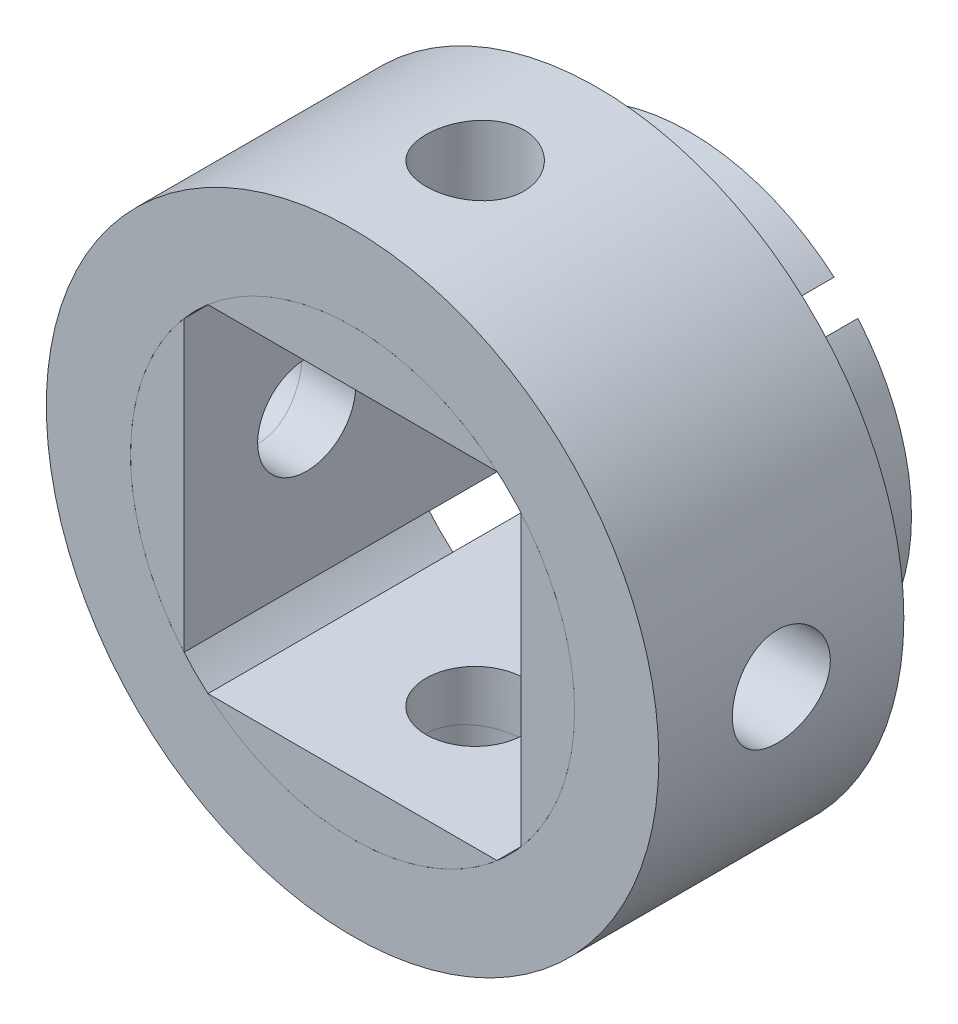
from build123d import *

# Parameters (mm, degrees)
SKETCH_1_R               = 10
SKETCH_1_R_2             = 7.25
EXTRUDE_1_DEPTH          = 8
SKETCH_2_R               = 1.6
CUT_EXTRUDE_1_DEPTH      = 17.248076809
SKETCH_3_R               = 1.6
CUT_EXTRUDE_2_DEPTH      = 17.248076998
EXTRUDE_2_DEPTH          = 8
EXTRUDE_2_DEPTH_BACK     = 3
EXTRUDE_2_2_DEPTH        = 8
EXTRUDE_2_2_DEPTH_BACK   = 3
EXTRUDE_2_3_DEPTH        = 8
EXTRUDE_2_3_DEPTH_BACK   = 3
EXTRUDE_2_4_DEPTH        = 8
EXTRUDE_2_4_DEPTH_BACK   = 3
SKETCH_2_2_R             = 1.6
CUT_EXTRUDE_3_DEPTH      = 17.248076998
CUT_EXTRUDE_5_DEPTH      = 17.248076998
CUT_EXTRUDE_5_DEPTH_BACK = 17.248076998
SKETCH_3_3_R             = 1.6
SKETCH_2_3_R             = 1.6
CUT_EXTRUDE_6_DEPTH      = 17.248076998


with BuildPart() as part:
    # 草图1 → 凸台-拉伸1 (new body)
    with BuildSketch(Plane.XY):
        Circle(SKETCH_1_R)
        Circle(SKETCH_1_R_2, mode=Mode.SUBTRACT)
    extrude(amount=EXTRUDE_1_DEPTH)

    # 草图2 → 切除-拉伸1 (cut, through all)
    with BuildSketch(Plane(origin=(0, 0, 0), x_dir=(1, 0, 0), z_dir=(0, 1, 0))):
        with Locations((0, -4)):
            Circle(SKETCH_2_R)
    extrude(amount=-CUT_EXTRUDE_1_DEPTH, mode=Mode.SUBTRACT)

    # 草图3 → 切除-拉伸2 (cut, through all)
    with BuildSketch(Plane(origin=(0, 0, 0), x_dir=(0, 0, -1), z_dir=(1, 0, 0))):
        with Locations((-4, 0)):
            Circle(SKETCH_3_R)
    extrude(amount=-CUT_EXTRUDE_2_DEPTH, mode=Mode.SUBTRACT)


with BuildPart() as body_2:
    # 草图5 → 凸台-拉伸2 (new, two sides: drawn at the far end of the back side and taken through both)
    with BuildSketch(Plane.XY.offset(-EXTRUDE_2_DEPTH_BACK)):
        with BuildLine():
            Line((4.723610907, 5.5), (-4.723610907, 5.5))
            ThreePointArc((-4.723610907, 5.5), (0, 7.25), (4.723610907, 5.5))
        make_face()
    extrude(amount=EXTRUDE_2_DEPTH + EXTRUDE_2_DEPTH_BACK)


with BuildPart() as body_3:
    # 草图5 → Extrude 2 2 (new, two sides: drawn at the far end of the back side and taken through both)
    with BuildSketch(Plane.XY.offset(-EXTRUDE_2_2_DEPTH_BACK)):
        with BuildLine():
            Line((5.5, -4.723610907), (5.5, 4.723610907))
            ThreePointArc((5.5, 4.723610907), (7.25, 0), (5.5, -4.723610907))
        make_face()
    extrude(amount=EXTRUDE_2_2_DEPTH + EXTRUDE_2_2_DEPTH_BACK)


with BuildPart() as body_4:
    # 草图5 → Extrude 2 3 (new, two sides: drawn at the far end of the back side and taken through both)
    with BuildSketch(Plane.XY.offset(-EXTRUDE_2_3_DEPTH_BACK)):
        with BuildLine():
            Line((-4.723610907, -5.5), (4.723610907, -5.5))
            ThreePointArc((4.723610907, -5.5), (0, -7.25), (-4.723610907, -5.5))
        make_face()
    extrude(amount=EXTRUDE_2_3_DEPTH + EXTRUDE_2_3_DEPTH_BACK)

    # 草图2<2> → 切除-拉伸3 (cut, through all)
    with BuildSketch(Plane(origin=(0, 0, 0), x_dir=(1, 0, 0), z_dir=(0, 1, 0))):
        with Locations((0, -4)):
            Circle(SKETCH_2_2_R)
    extrude(amount=-CUT_EXTRUDE_3_DEPTH, mode=Mode.SUBTRACT)


with BuildPart() as body_5:
    # 草图5 → Extrude 2 4 (new, two sides: drawn at the far end of the back side and taken through both)
    with BuildSketch(Plane.XY.offset(-EXTRUDE_2_4_DEPTH_BACK)):
        with BuildLine():
            Line((-5.5, 4.723610907), (-5.5, -4.723610907))
            ThreePointArc((-5.5, -4.723610907), (-7.25, 0), (-5.5, 4.723610907))
        make_face()
    extrude(amount=EXTRUDE_2_4_DEPTH + EXTRUDE_2_4_DEPTH_BACK)


with BuildPart() as cut_extrude_5_tool:
    # 草图3<3> → 切除-拉伸5 (new, two sides: drawn at the far end of the back side and taken through both)
    with BuildSketch(Plane(origin=(0, 0, 0), x_dir=(0, 0, -1), z_dir=(1, 0, 0)).offset(-CUT_EXTRUDE_5_DEPTH_BACK)):
        with Locations((-4, 0)):
            Circle(SKETCH_3_3_R)
    extrude(amount=CUT_EXTRUDE_5_DEPTH + CUT_EXTRUDE_5_DEPTH_BACK)


with BuildPart() as part_1:
    add(part.part)

    # 切除-拉伸5: cut by cut_extrude_5_tool
    add(cut_extrude_5_tool.part, mode=Mode.SUBTRACT)


with BuildPart() as body_3_1:
    add(body_3.part)

    # 切除-拉伸5: cut by cut_extrude_5_tool
    add(cut_extrude_5_tool.part, mode=Mode.SUBTRACT)


with BuildPart() as body_5_1:
    add(body_5.part)

    # 切除-拉伸5: cut by cut_extrude_5_tool
    add(cut_extrude_5_tool.part, mode=Mode.SUBTRACT)


with BuildPart() as cut_extrude_6_tool:
    # 草图2<3> → 切除-拉伸6 (new, through all)
    with BuildSketch(Plane(origin=(0, 0, 0), x_dir=(1, 0, 0), z_dir=(0, 1, 0))):
        with Locations((0, -4)):
            Circle(SKETCH_2_3_R)
    extrude(amount=CUT_EXTRUDE_6_DEPTH)


with BuildPart() as part_2:
    add(part_1.part)

    # 切除-拉伸6: cut by cut_extrude_6_tool
    add(cut_extrude_6_tool.part, mode=Mode.SUBTRACT)


with BuildPart() as body_2_1:
    add(body_2.part)

    # 切除-拉伸6: cut by cut_extrude_6_tool
    add(cut_extrude_6_tool.part, mode=Mode.SUBTRACT)


solid = Compound([body_4.part, body_3_1.part, body_5_1.part, part_2.part, body_2_1.part])
